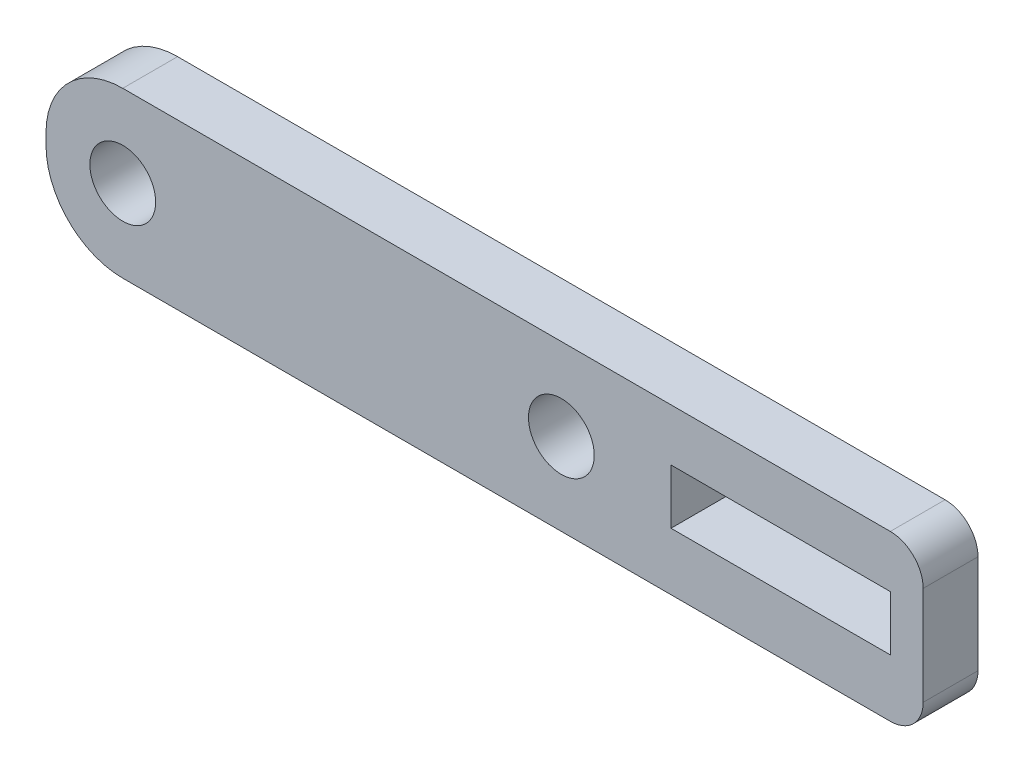
from build123d import *

# Parameters (mm, degrees)
SKETCH1_R           = 3
SKETCH1_W           = 20
SKETCH1_H           = 5
BOSS_EXTRUDE1_DEPTH = 5


with BuildPart() as part:
    # Sketch1 → Boss-Extrude1 (new body)
    with BuildSketch(Plane.XY):
        with BuildLine():
            Line((7, 0), (77, 0))
            ThreePointArc((77, 0), (79.121320344, 0.878679656), (80, 3))
            Line((80, 3), (80, 12))
            ThreePointArc((80, 12), (79.121320344, 14.121320344), (77, 15))
            Line((77, 15), (7, 15))
            ThreePointArc((7, 15), (2.050252532, 12.949747468), (0, 8))
            Line((0, 8), (0, 7))
            ThreePointArc((0, 7), (2.050252532, 2.050252532), (7, 0))
        make_face()
        with Locations((7, 7.5)):
            Circle(SKETCH1_R, mode=Mode.SUBTRACT)
        with Locations((47, 7.5)):
            Circle(SKETCH1_R, mode=Mode.SUBTRACT)
        with Locations((67, 7.75)):
            Rectangle(SKETCH1_W, SKETCH1_H, mode=Mode.SUBTRACT)
    extrude(amount=BOSS_EXTRUDE1_DEPTH)


solid = part.part
